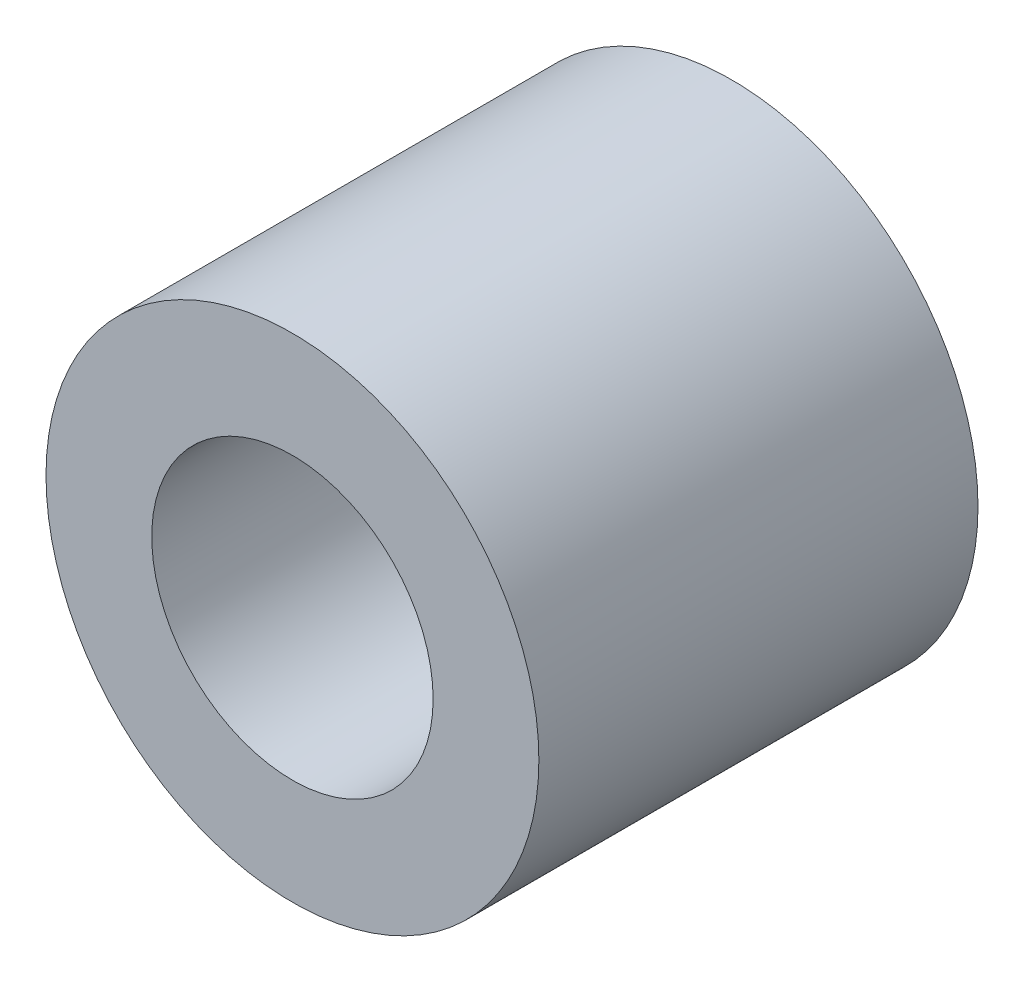
from build123d import *

# Parameters (mm, degrees)
SKETCH1_R           = 7.015
SKETCH1_R_2         = 4.005
BOSS_EXTRUDE1_DEPTH = 6.25


with BuildPart() as part:
    # Sketch1 → Boss-Extrude1 (new, symmetric)
    with BuildSketch(Plane.XY):
        Circle(SKETCH1_R)
        Circle(SKETCH1_R_2, mode=Mode.SUBTRACT)
    extrude(amount=BOSS_EXTRUDE1_DEPTH, both=True)


solid = part.part
